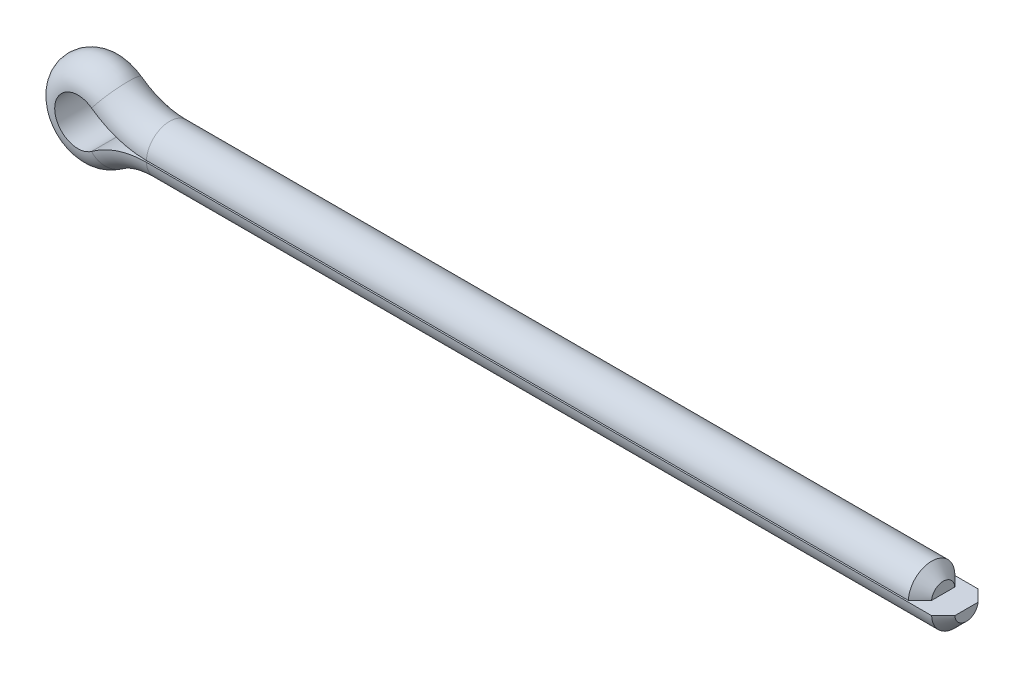
from build123d import *

# Parameters (mm, degrees)
CHAMFER1_SIZE = 0.381


with BuildPart() as part:
    # Sweep1: sweep along a path in Sketch3
    with BuildLine(Plane.XY) as sweep1_path:
        Line((0.762, -0.0254), (-25.4, -0.0254))
        ThreePointArc((-25.4, -0.0254), (-26.347661712, -0.176463466), (-27.201388343, -0.61468))
        ThreePointArc((-27.201388343, -0.61468), (-28.413735429, 0), (-27.201388343, 0.61468))
        ThreePointArc((-27.201388343, 0.61468), (-26.347661712, 0.176463466), (-25.4, 0.0254))
        Line((-25.4, 0.0254), (0, 0.0254))
    # Sketch4 → Sweep1 (sweep)
    with BuildSketch(Plane(origin=(0, 0, 0), x_dir=(0, 0, -1), z_dir=(1, 0, 0))):
        with BuildLine():
            Line((-0.761576549, 0.0254), (0.761576549, 0.0254))
            ThreePointArc((0.761576549, 0.0254), (0, 0.762), (-0.761576549, 0.0254))
        make_face()
    sweep(path=sweep1_path.line)

    # Chamfer1
    chamfer1_edges = [part.edges().sort_by_distance(p)[0] for p in [
        (0, 0.762, 0),
        (0.762, -0.762, 0),
    ]]
    chamfer(chamfer1_edges, length=CHAMFER1_SIZE)


solid = part.part
